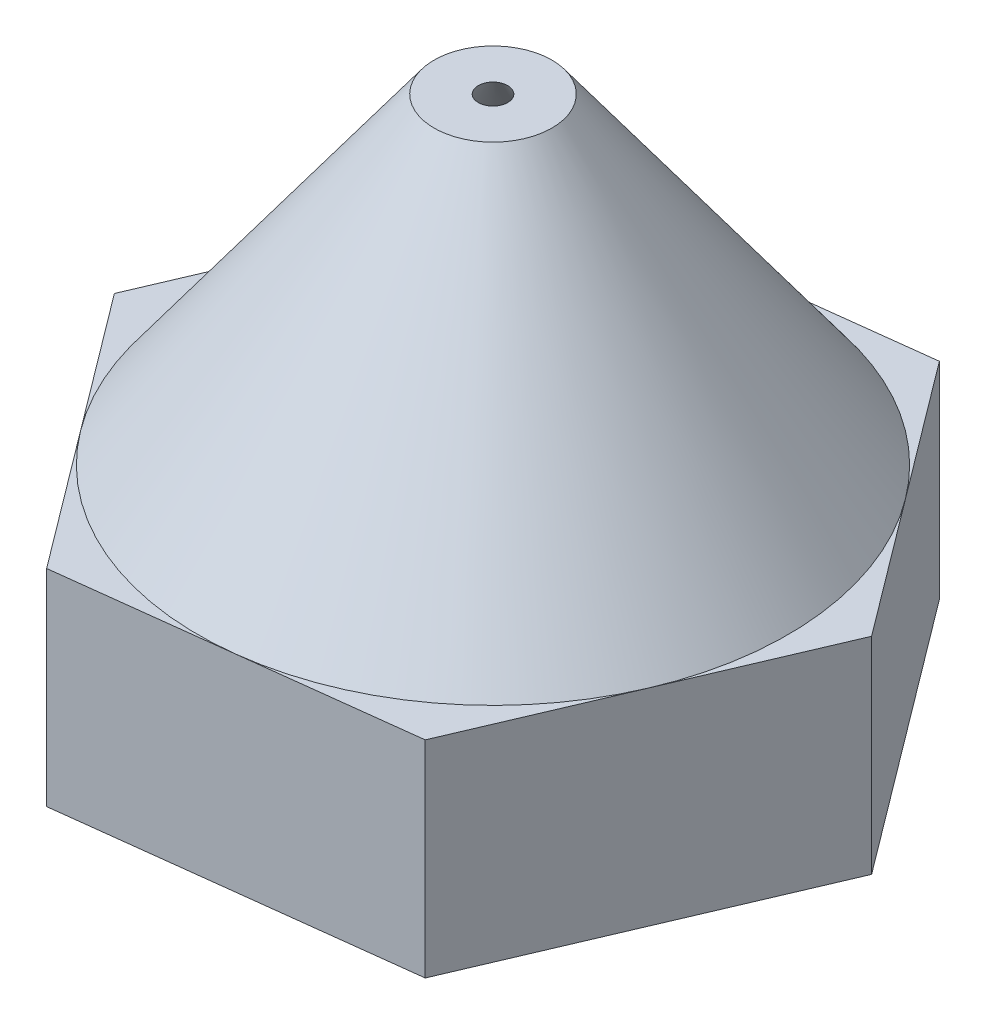
from build123d import *

# Parameters (mm, degrees)
SKETCH10_R          = 3
BOSS_EXTRUDE2_DEPTH = 3.5


with BuildPart() as part:
    # Sketch1 → Revolve1 (revolve)
    with BuildSketch(Plane.XY, mode=Mode.PRIVATE) as revolve1_sk:
        Polygon((0, 0), (5, 0), (1, 5.45), (0, 5.45), align=None)
    revolve(revolve1_sk.sketch.rotate(Axis((0, -3.7, 0), (0, 1, 0)), 90), axis=Axis((0, -3.7, 0), (0, 1, 0)))

    # Sketch3 → Cut-Revolve1 (revolve, cut)
    with BuildSketch(Plane.XY, mode=Mode.PRIVATE) as cut_revolve1_sk:
        Polygon((-1.65, 3.4), (-1.65, 2.4), (-3, 0), (0, 0), (0, 3.4), align=None)
        Polygon((-0.25, 5.45), (0, 5.45), (0, 3.4), (-1.65, 3.4), align=None)
    revolve(cut_revolve1_sk.sketch.rotate(Axis((0, 0, 0), (0, 1, 0)), 270), axis=Axis((0, 0, 0), (0, 1, 0)), mode=Mode.SUBTRACT)

    # Sketch10 → Boss-Extrude2 (add)
    with BuildSketch(Plane.XZ):
        Polygon((5.731649919, -0.693918255), (3.466775796, 4.616795308), (-2.264874122, 5.310713562), (-5.731649919, 0.693918255), (-3.466775796, -4.616795308), (2.264874122, -5.310713562), align=None)
        with Locations(Location((0, 0, 0), (0, 0, 270))):
            Circle(SKETCH10_R, mode=Mode.SUBTRACT)
    extrude(amount=BOSS_EXTRUDE2_DEPTH)


solid = part.part
